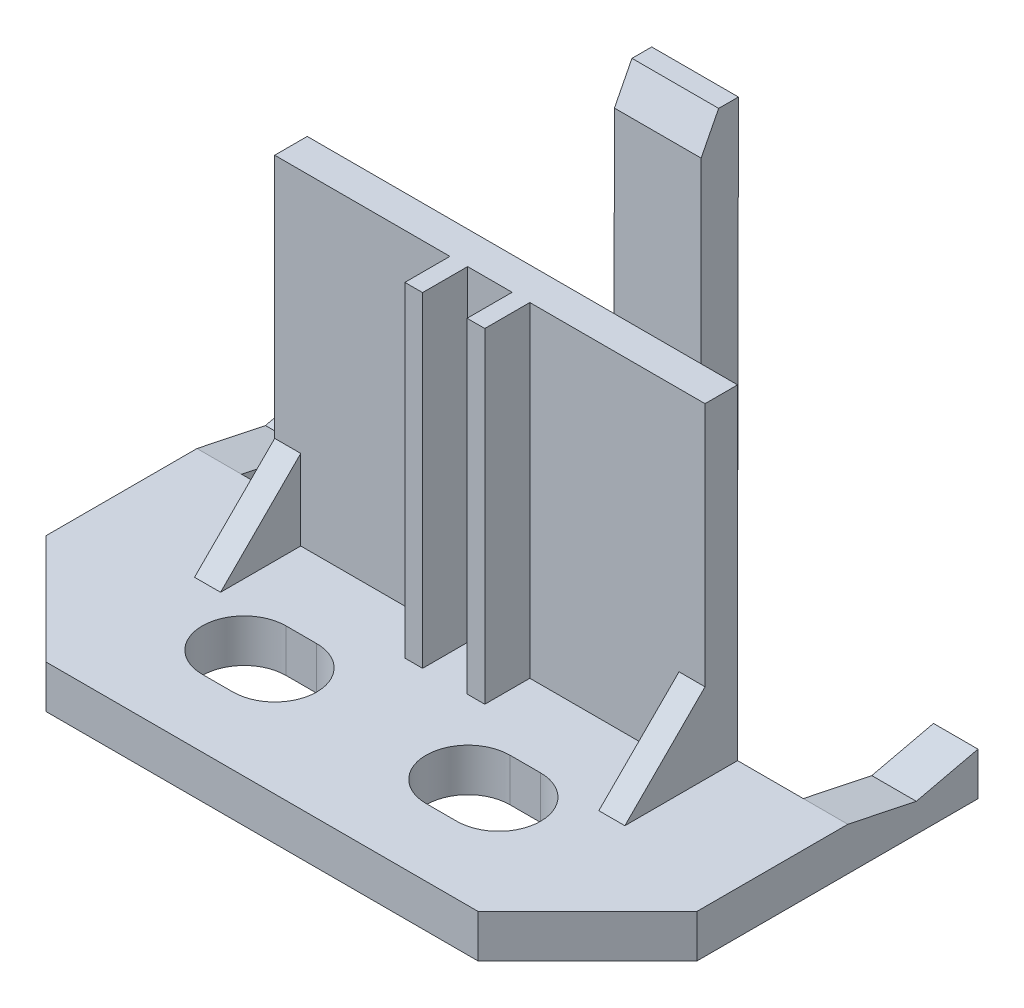
from build123d import *

# Parameters (mm, degrees)
BOSS_EXTRUDE1_DEPTH = 2.0955
SKETCH2_W           = 20.9931
SKETCH2_H           = 1.5875
BOSS_EXTRUDE2_DEPTH = 15.875
BOSS_EXTRUDE3_DEPTH = 1.27
SKETCH5_W           = 0.8636
SKETCH5_H           = 2.1971
BOSS_EXTRUDE4_DEPTH = 15.875
SKETCH6_R           = 1.0795
BOSS_EXTRUDE5_DEPTH = 2.032
BOSS_EXTRUDE6_DEPTH = 2.1717
SKETCH8_W           = 4.2291
SKETCH8_H           = 8.382
BOSS_EXTRUDE7_DEPTH = 2.0955
BOSS_EXTRUDE8_DEPTH = 2.11455


with BuildPart() as part:
    # Sketch1 → Boss-Extrude1 (new body)
    with BuildSketch(Plane(origin=(0, 0, 0), x_dir=(1, 0, 0), z_dir=(0, 1, 0))):
        Polygon((10.541, 0), (15.875, 5.334), (15.875, 12.7), (-15.875, 12.7), (-15.875, 5.334), (-10.541, 0), align=None)
        with BuildLine():
            Line((-6.2103, 7.3787), (-4.7117, 7.3787))
            ThreePointArc((-4.7117, 7.3787), (-2.667, 5.334), (-4.7117, 3.2893))
            Line((-4.7117, 3.2893), (-6.2103, 3.2893))
            ThreePointArc((-6.2103, 3.2893), (-8.255, 5.334), (-6.2103, 7.3787))
        make_face(mode=Mode.SUBTRACT)
        with BuildLine():
            Line((6.2103, 7.3787), (4.7117, 7.3787))
            ThreePointArc((4.7117, 7.3787), (2.667, 5.334), (4.7117, 3.2893))
            Line((4.7117, 3.2893), (6.2103, 3.2893))
            ThreePointArc((6.2103, 3.2893), (8.255, 5.334), (6.2103, 7.3787))
        make_face(mode=Mode.SUBTRACT)
    extrude(amount=BOSS_EXTRUDE1_DEPTH)

    # Sketch2 → Boss-Extrude2 (add)
    with BuildSketch(Plane(origin=(0, 2.0955, 0), x_dir=(1, 0, 0), z_dir=(0, 1, 0))):
        with Locations((0, 11.90625)):
            Rectangle(SKETCH2_W, SKETCH2_H)
    extrude(amount=BOSS_EXTRUDE2_DEPTH)

    # Sketch4 → Boss-Extrude3 (add)
    with BuildSketch(Plane.ZY.offset(10.49655)):
        Polygon((-11.1125, 6.0071), (-7.2009, 2.0955), (-11.1125, 2.0955), align=None)
    boss_extrude3 = extrude(amount=-BOSS_EXTRUDE3_DEPTH)

    # Sketch5 → Boss-Extrude4 (add)
    with BuildSketch(Plane(origin=(0, 17.9705, 0), x_dir=(1, 0, 0), z_dir=(0, 1, 0))):
        with Locations((-1.51765, 10.01395)):
            Rectangle(SKETCH5_W, SKETCH5_H)
    boss_extrude4 = extrude(amount=-BOSS_EXTRUDE4_DEPTH)

    # Sketch6 → Boss-Extrude5 (add)
    with BuildSketch(Plane(origin=(0, 0, -12.7), x_dir=(-1, 0, 0), z_dir=(0, 0, -1))):
        with Locations(Location((4.60375, 14.6431, 0), (0, 0, 180))):
            Circle(SKETCH6_R)
    boss_extrude5 = extrude(amount=BOSS_EXTRUDE5_DEPTH)

    # Sketch7 → Boss-Extrude6 (add)
    with BuildSketch(Plane.ZY.offset(15.875)):
        Polygon((-12.7, 0), (-19.05, 0), (-19.05, 2.0955), (-16.0401, 1.397), (-12.7, 2.0955), align=None)
    boss_extrude6 = extrude(amount=-BOSS_EXTRUDE6_DEPTH)

    # Mirror1: Boss-Extrude3, Boss-Extrude4, Boss-Extrude5, Boss-Extrude6 across plane
    add(boss_extrude3.mirror(Plane(origin=(0, 0, 0), x_dir=(0, 0, 1), z_dir=(1, 0, 0))))
    add(boss_extrude4.mirror(Plane(origin=(0, 0, 0), x_dir=(0, 0, 1), z_dir=(1, 0, 0))))
    add(boss_extrude5.mirror(Plane(origin=(0, 0, 0), x_dir=(0, 0, 1), z_dir=(1, 0, 0))))
    add(boss_extrude6.mirror(Plane(origin=(0, 0, 0), x_dir=(0, 0, 1), z_dir=(1, 0, 0))))

    # Sketch8 → Boss-Extrude7 (add)
    with BuildSketch(Plane(origin=(0, 0, 0), x_dir=(-1, 0, 0), z_dir=(0, -1, 0))):
        with Locations((0, 16.891)):
            Rectangle(SKETCH8_W, SKETCH8_H)
    extrude(amount=-BOSS_EXTRUDE7_DEPTH)

    # Sketch9 → Boss-Extrude8 (add, symmetric)
    with BuildSketch(Plane(origin=(0, 0, 0), x_dir=(0, 0, -1), z_dir=(1, 0, 0))):
        Polygon((21.082, 2.0955), (21.123652242, 21.7297), (20.158454414, 21.731747583), (19.304, 20.057156461), (19.265895913, 2.0955), align=None)
    extrude(amount=BOSS_EXTRUDE8_DEPTH, both=True)


solid = part.part
